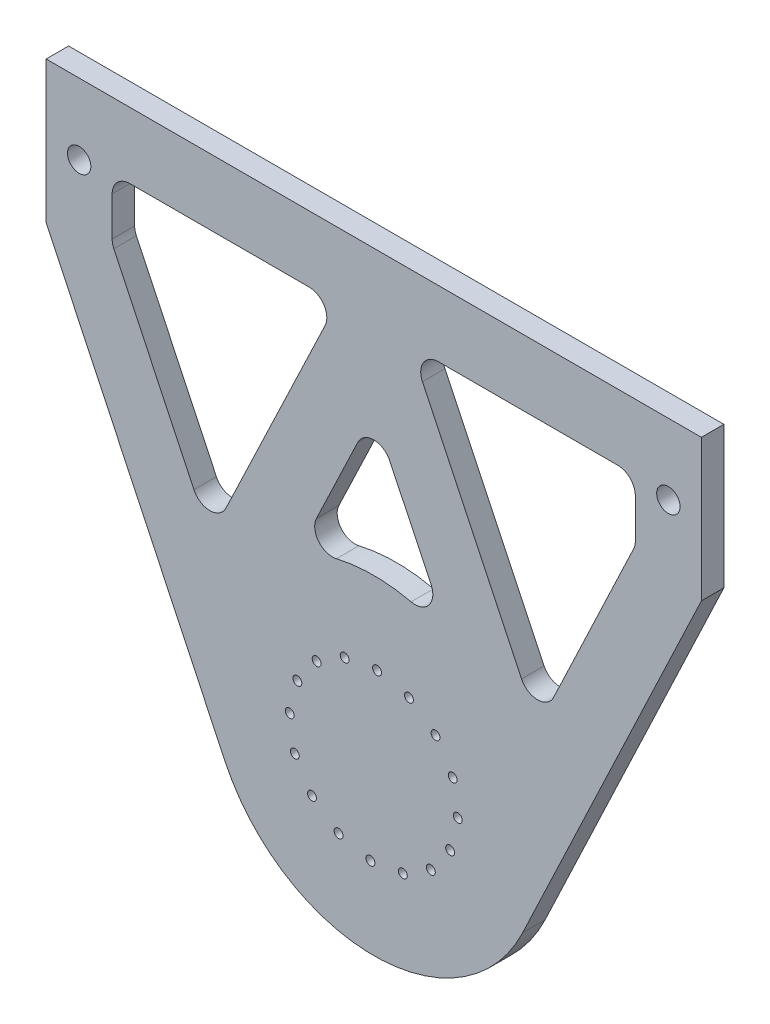
from build123d import *

# Parameters (mm, degrees)
BOSS_EXTRUDE1_DEPTH     = 3.175
CUT_EXTRUDE2_DEPTH      = 157.840117636
CUT_EXTRUDE2_DEPTH_BACK = 157.840117636
SKETCH3_R               = 1.25
CUT_EXTRUDE3_DEPTH      = 157.840117636
CUT_EXTRUDE3_DEPTH_BACK = 157.840117636
BOSS_EXTRUDE2_DEPTH     = 6.35
FILLET1_R               = 5
M6_CLEARANCE_HOLE1_D    = 6.6


with BuildPart() as part:
    # Sketch1 → Boss-Extrude1 (new, symmetric)
    with BuildSketch(Plane.XY):
        with BuildLine():
            Line((92.5, 126.5), (-92.5, 126.5))
            Line((-92.5, 126.5), (-92.5, 86.5))
            Line((-92.5, 86.5), (-42.012601066, -19.929660099))
            ThreePointArc((-42.012601066, -19.929660099), (0, -46.5), (42.012601066, -19.929660099))
            Line((42.012601066, -19.929660099), (92.5, 86.5))
            Line((92.5, 86.5), (92.5, 126.5))
        make_face()
    extrude(amount=BOSS_EXTRUDE1_DEPTH, both=True)

    # Sketch3 → Cut-Extrude2 (cut, two sides: drawn at the far end of the back side and taken through both)
    with BuildSketch(Plane(origin=(0, 0, -3.175), x_dir=(-1, 0, 0), z_dir=(0, 0, -1)).offset(-CUT_EXTRUDE2_DEPTH_BACK)):
        with Locations((17.440159599, -16.121517706)):
            Circle(SKETCH3_R)
        with Locations((22.282044228, -8.220280106)):
            Circle(SKETCH3_R)
        with Locations((9.943168767, -21.568400378)):
            Circle(SKETCH3_R)
        with Locations((0.932420624, -23.731689611)):
            Circle(SKETCH3_R)
        with Locations((-8.220280106, -22.282044228)):
            Circle(SKETCH3_R)
        with Locations((-16.121517706, -17.440159599)):
            Circle(SKETCH3_R)
        with Locations((-21.568400378, -9.943168767)):
            Circle(SKETCH3_R)
        with Locations((-23.731689611, -0.932420624)):
            Circle(SKETCH3_R)
        with Locations((-22.282044228, 8.220280106)):
            Circle(SKETCH3_R)
        with Locations((-17.440159599, 16.121517706)):
            Circle(SKETCH3_R)
        with Locations((-9.943168767, 21.568400378)):
            Circle(SKETCH3_R)
        with Locations((-0.932420624, 23.731689611)):
            Circle(SKETCH3_R)
        with Locations((8.220280106, 22.282044228)):
            Circle(SKETCH3_R)
        with Locations((16.121517706, 17.440159599)):
            Circle(SKETCH3_R)
        with Locations((21.568400378, 9.943168767)):
            Circle(SKETCH3_R)
        with Locations((23.731689611, 0.932420624)):
            Circle(SKETCH3_R)
    extrude(amount=CUT_EXTRUDE2_DEPTH + CUT_EXTRUDE2_DEPTH_BACK, mode=Mode.SUBTRACT)

    # Sketch4 → Cut-Extrude3 (cut, two sides: drawn at the far end of the back side and taken through both)
    with BuildSketch(Plane(origin=(0, 0, -3.175), x_dir=(-1, 0, 0), z_dir=(0, 0, -1)).offset(-CUT_EXTRUDE3_DEPTH_BACK)):
        with BuildLine():
            Line((-41.126950817, 21.698477285), (-73.85821292, 90.697419076))
            Line((-73.85821292, 90.697419076), (-73.85821292, 107.85821292))
            Line((-73.85821292, 107.85821292), (73.85821292, 107.85821292))
            Line((73.85821292, 107.85821292), (73.85821292, 90.697419076))
            Line((73.85821292, 90.697419076), (41.126950817, 21.698477285))
            ThreePointArc((41.126950817, 21.698477285), (0, 46.5), (-41.126950817, 21.698477285))
        make_face()
    extrude(amount=CUT_EXTRUDE3_DEPTH + CUT_EXTRUDE3_DEPTH_BACK, mode=Mode.SUBTRACT)

    # Sketch6 → Boss-Extrude2 (add)
    with BuildSketch(Plane.XY.offset(3.175)):
        Polygon((-32.71522073, 17.68327451), (0, 86.220686434), (32.71522073, 17.68327451), (49.538680905, 25.71368006), (10.328321936, 107.85821292), (-10.328321936, 107.85821292), (-49.538680905, 25.71368006), align=None)
    extrude(amount=-BOSS_EXTRUDE2_DEPTH)

    # Fillet1
    fillet1_edges = [part.edges().sort_by_distance(p)[0] for p in [
        (73.85821292, 90.697419076, 0),
        (73.85821292, 107.85821292, 0),
        (-73.85821292, 107.85821292, 0),
        (-73.85821292, 90.697419076, 0),
        (-46.275048201, 32.550893259, 0),
        (-21.466818467, 41.248341844, 0),
        (21.466818467, 41.248341844, 0),
        (0, 86.220686434, 0),
        (10.328321936, 107.85821292, 0),
        (-10.328321936, 107.85821292, 0),
        (46.275048201, 32.550893259, 0),
    ]]
    fillet(fillet1_edges, radius=FILLET1_R)

    # M6 Clearance Hole1 (through all)
    with Locations(Plane.XY.offset(3.175)):
        with Locations((83.17910646, 106.5), (-83.17910646, 106.5)):
            Hole(M6_CLEARANCE_HOLE1_D / 2)


solid = part.part
